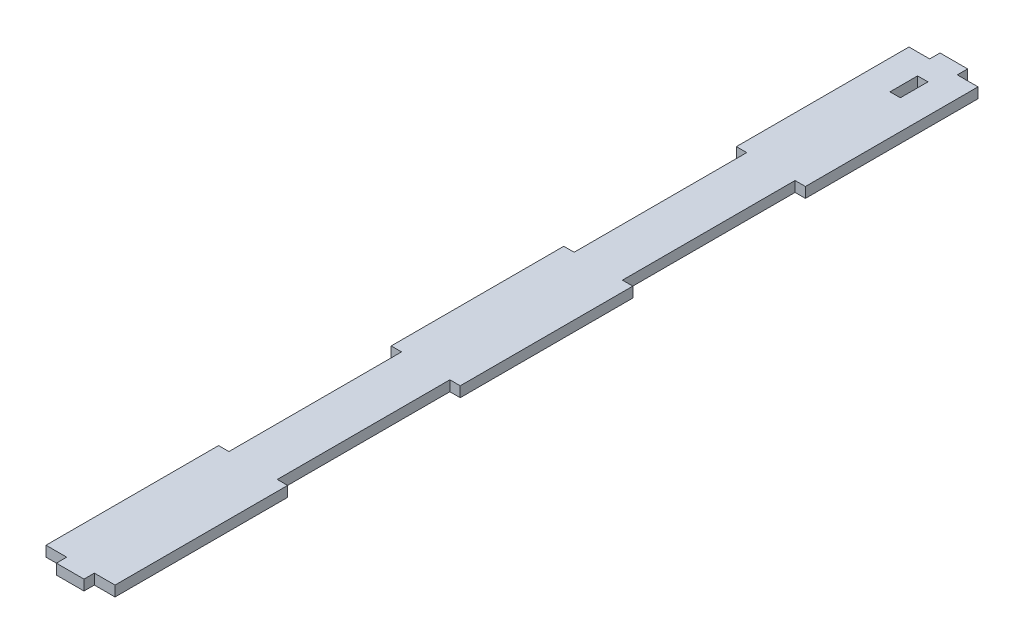
from build123d import *

# Parameters (mm, degrees)
SALIENTE_EXTRUIR1_DEPTH = 3


with BuildPart() as part:
    # Croquis1 → Saliente-Extruir1 (new body)
    with BuildSketch(Plane(origin=(0, 0, 0), x_dir=(1, 0, 0), z_dir=(0, 1, 0))):
        Polygon((20, 250), (14, 250), (14, 253), (10, 253), (6, 253), (6, 250), (3, 250), (0, 250), (0, 200), (3, 200), (3, 150), (0, 150), (0, 100), (3, 100), (3, 50), (0, 50), (0, 0), (6, 0), (6, -3), (14, -3), (14, 0), (20, 0), (20, 50), (17, 50), (17, 100), (20, 100), (20, 125), (20, 150), (17, 150), (17, 200), (20, 200), align=None)
        Polygon((8.5, 244), (10, 244), (11.5, 244), (11.5, 236), (8.5, 236), align=None, mode=Mode.SUBTRACT)
    extrude(amount=SALIENTE_EXTRUIR1_DEPTH)


solid = part.part
